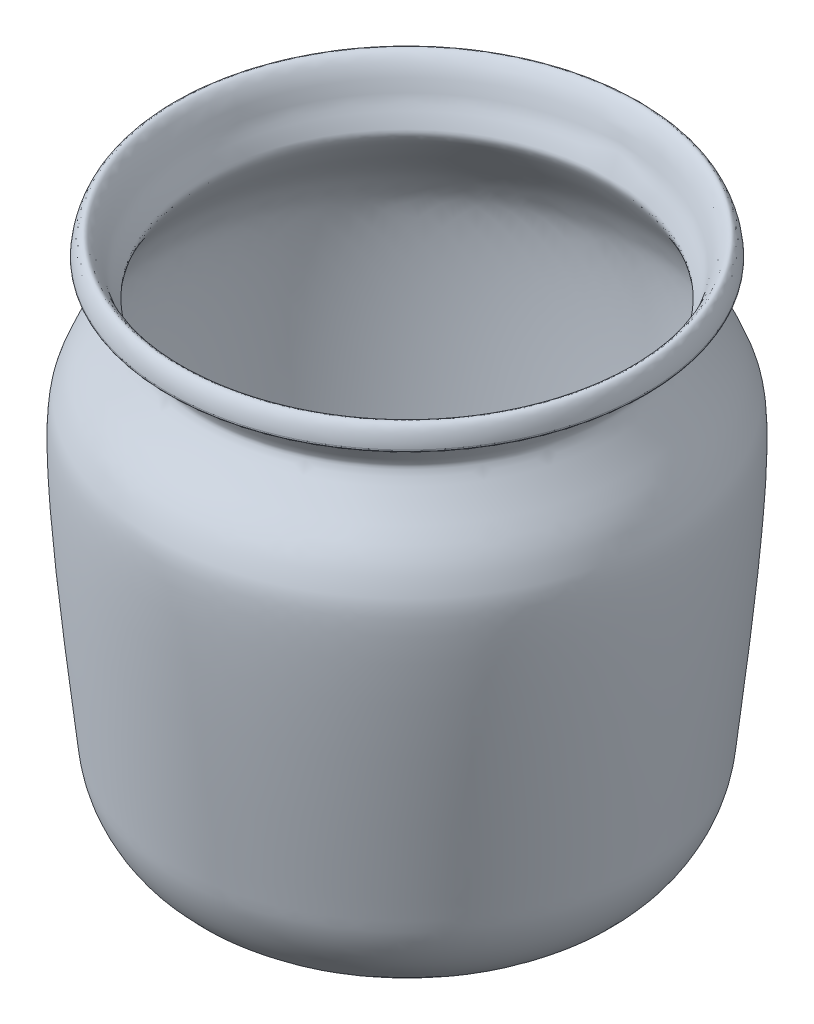
from build123d import *

# Parameters (mm, degrees)
SHELL1_T                       = -1.999996
CUT_EXTRUDE1_REACH             = 617.079
SKETCH3_R                      = 76.2
FILLET1_R                      = 0.762
CUT_EXTRUDE2_REACH             = 617.079
SKETCH4_R                      = 10.999978
CUT_EXTRUDE2_DIRECTION_2_DEPTH = 616.079017673
CIRPATTERN8_COUNT              = 9


with BuildPart() as part:
    # Sketch1 → Revolve1 (revolve)
    with BuildSketch(Plane.XY, mode=Mode.PRIVATE) as revolve1_sk:
        with BuildLine():
            Line((0, 10.632180728), (0, 544.032180728))
            Line((0, 544.032180728), (249.550463333, 544.032180728))
            Line((249.550463333, 544.032180728), (249.550463333, 493.232180728))
            Line((249.550463333, 493.232180728), (222.25, 493.232180728))
            add(Edge.make_bspline(
                [(0, 10.632180728), (91.280139084, 10.632180728), (93.719969858, 10.730702419), (110.202712653, 10.503879485), (147.029710148, 13.865235876), (199.083664984, 43.457278301), (217.357372472, 78.921876375), (221.409069091, 124.461526132), (247.871427447, 352.61666112), (232.519776437, 391.802866552), (224.63137064, 412.002819626), (190.790325468, 455.065715671), (194.508764714, 467.393820513), (202.812295704, 482.400433226), (204.679506178, 496.538623752), (213.049205581, 511.660892958), (218.908547148, 510.509197961), (222.445921892, 499.572098873), (222.25, 493.232180728)],
                knots=[0, 0, 0, 0, 0.148264616, 0.184498669, 0.34258032, 0.376883379, 0.493226194, 0.520597128, 0.623221779, 0.639919327, 0.674744528, 0.738436354, 0.754448901, 0.834869996, 0.871421603, 0.928140008, 0.940997847, 1, 1, 1, 1], degree=3))
        make_face()
    revolve(revolve1_sk.sketch.rotate(Axis((0, 10.632180728, 0), (0, 1, 0)), 90), axis=Axis((0, 10.632180728, 0), (0, 1, 0)))

    # Shell1
    shell1_openings = [part.faces().sort_by_distance(p)[0] for p in [
        (0, 544.032180728, 0),
    ]]
    offset(amount=SHELL1_T, openings=shell1_openings)

    # Sketch2 → Cut-Revolve1 (revolve, cut)
    with BuildSketch(Plane.XY, mode=Mode.PRIVATE) as cut_revolve1_sk:
        Polygon((-224.228431254, 495.232176728), (-224.486037665, 490.382098059), (-251.210830661, 480.937177958), (-258.082982369, 518.819914246), (-258.082982369, 570.59559534), (-222.975896215, 558.311446802), (-224.900195586, 515.059981995), (-224.900195586, 503.265679058), align=None)
    revolve(cut_revolve1_sk.sketch.rotate(Axis((0, 588.715500964, 0), (0, -1, 0)), 90), axis=Axis((0, 588.715500964, 0), (0, -1, 0)), mode=Mode.SUBTRACT)

    # Sketch3 → Cut-Extrude1 (cut, up to next)
    with BuildSketch(Plane(origin=(0, 0, 0), x_dir=(1, 0, 0), z_dir=(0, 1, 0)), mode=Mode.PRIVATE) as cut_extrude1_sk1:
        with Locations(Location((0, 0, 0), (0, 0, 90))):
            Circle(SKETCH3_R)
    cut_extrude1_tool1 = extrude(cut_extrude1_sk1.sketch, amount=CUT_EXTRUDE1_REACH, mode=Mode.PRIVATE) & part.part
    add(cut_extrude1_tool1.solids().sort_by_distance((0, 0, 0))[0], mode=Mode.SUBTRACT)

    # Fillet1
    fillet1_edges = [part.edges().sort_by_distance(p)[0] for p in [
        (0, 493.232180728, 224.334658767),
        (0, 493.232180728, 222.25),
    ]]
    fillet(fillet1_edges, radius=FILLET1_R)

    # Sketch4 → Cut-Extrude2 (cut, up to next)
    with BuildSketch(Plane(origin=(0, 0, 0), x_dir=(1, 0, 0), z_dir=(0, 1, 0)), mode=Mode.PRIVATE) as cut_extrude2_sk1:
        with Locations(Location((101.6, -10.999978, 0), (0, 0, 90))):
            Circle(SKETCH4_R)
    cut_extrude2_tool1 = extrude(cut_extrude2_sk1.sketch, amount=CUT_EXTRUDE2_REACH, mode=Mode.PRIVATE) & part.part
    cut_extrude2 = cut_extrude2_tool1.solids().sort_by_distance((101.6, 0, 10.999978))[0]
    add(cut_extrude2, mode=Mode.SUBTRACT)

    # Sketch4 → Cut-Extrude2 direction 2 (cut)
    with BuildSketch(Plane(origin=(0, 0, 0), x_dir=(1, 0, 0), z_dir=(0, 1, 0))):
        with Locations(Location((101.6, -10.999978, 0), (0, 0, 90))):
            Circle(SKETCH4_R)
    cut_extrude2_direction_2 = extrude(amount=-CUT_EXTRUDE2_DIRECTION_2_DEPTH, mode=Mode.SUBTRACT)

    # CirPattern8: Cut-Extrude2, Cut-Extrude2 direction 2 ×9 about axis
    cirpattern8_axis = Axis((0, 0, 0), (0, 1, 0))
    add([cut_extrude2.rotate(cirpattern8_axis, i * 360 / CIRPATTERN8_COUNT) for i in range(1, CIRPATTERN8_COUNT)], mode=Mode.SUBTRACT)
    add([cut_extrude2_direction_2.rotate(cirpattern8_axis, i * 360 / CIRPATTERN8_COUNT) for i in range(1, CIRPATTERN8_COUNT)], mode=Mode.SUBTRACT)


solid = part.part
